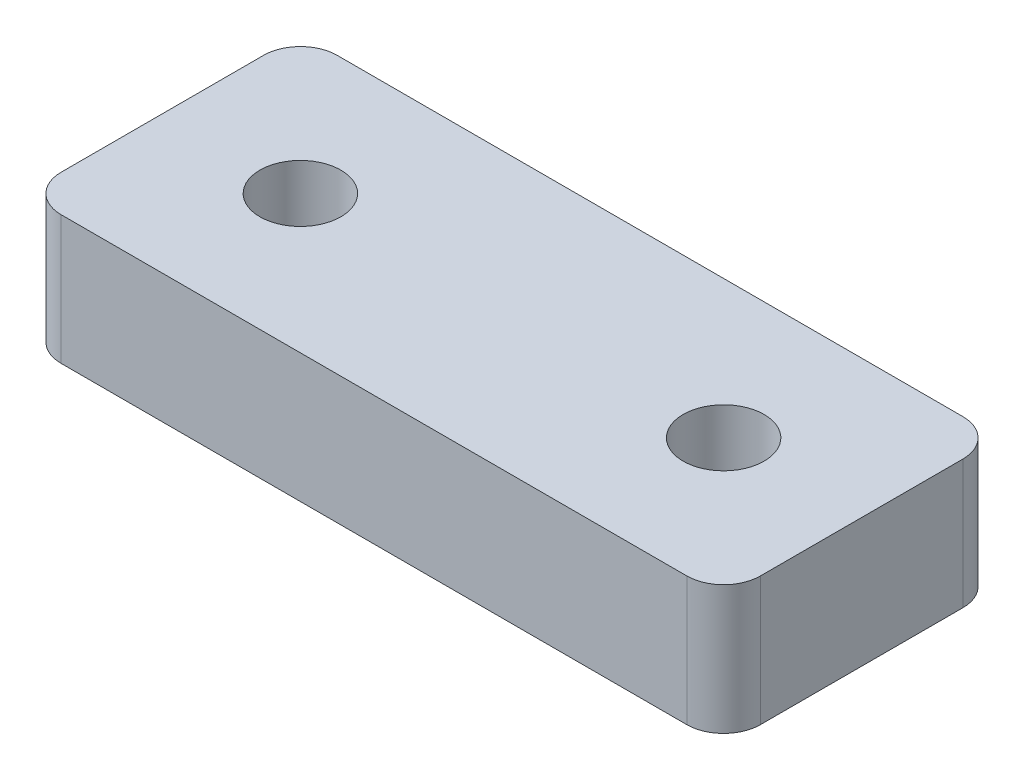
from build123d import *

# Parameters (mm, degrees)
SKETCH_1_W      = 38
SKETCH_1_H      = 15
SKETCH_1_R      = 2.2
EXTRUDE_1_DEPTH = 7
FILLET_1_R      = 2


with BuildPart() as part:
    # 草图1 → 凸台-拉伸1 (new body)
    with BuildSketch(Plane(origin=(0, 0, 0), x_dir=(1, 0, 0), z_dir=(0, 1, 0))):
        Rectangle(SKETCH_1_W, SKETCH_1_H)
        with Locations(Location((-11.5, 0, 0), (0, 0, 270))):
            Circle(SKETCH_1_R, mode=Mode.SUBTRACT)
        with Locations(Location((11.5, 0, 0), (0, 0, 90))):
            Circle(SKETCH_1_R, mode=Mode.SUBTRACT)
    extrude(amount=EXTRUDE_1_DEPTH)

    # 圆角1
    fillet_1_edges = [part.edges().sort_by_distance(p)[0] for p in [
        (19, 3.5, 7.5),
        (-19, 3.5, 7.5),
        (-19, 3.5, -7.5),
        (19, 3.5, -7.5),
    ]]
    fillet(fillet_1_edges, radius=FILLET_1_R)


solid = part.part
